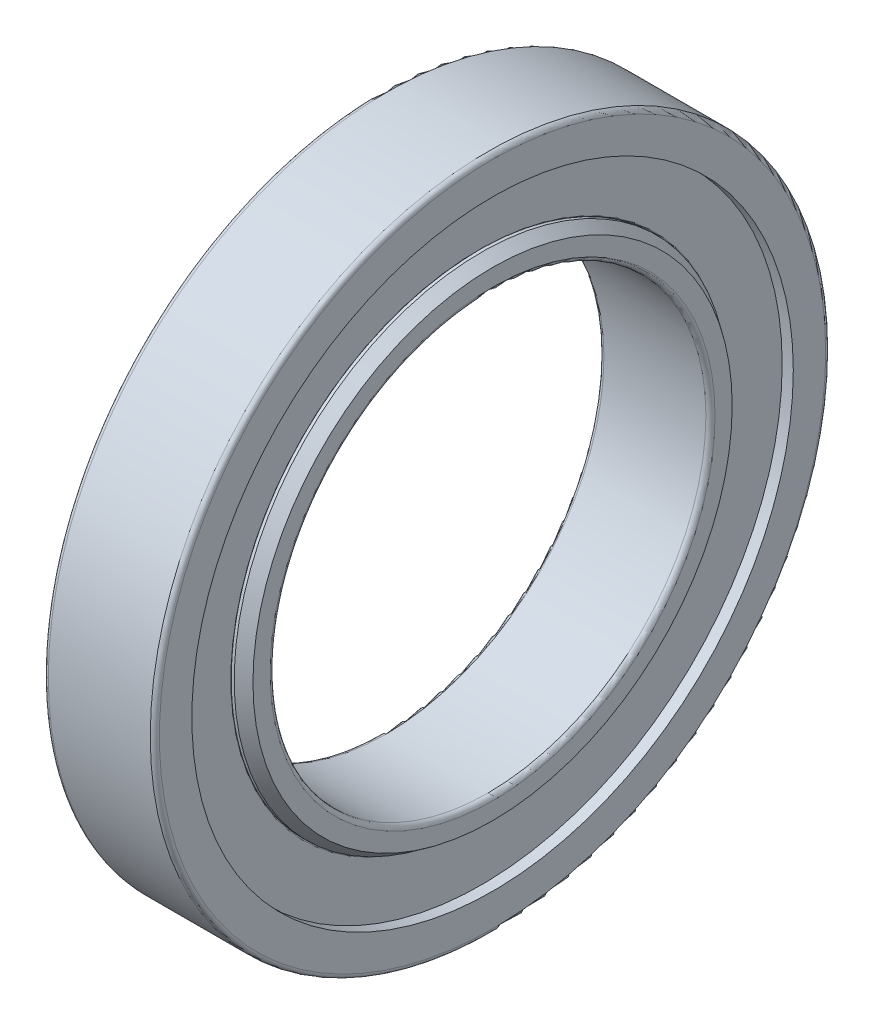
from build123d import *


with BuildPart() as part:
    # OutRacSke → OuterRace (revolve)
    with BuildSketch(Plane.XY):
        with BuildLine():
            Line((-20.4, 138.01875), (-25.5, 138.01875))
            Line((-25.5, 138.01875), (-25.5, 152.9))
            ThreePointArc((-25.5, 152.9), (-24.88492424, 154.38492424), (-23.4, 155))
            Line((-23.4, 155), (23.4, 155))
            ThreePointArc((23.4, 155), (24.88492424, 154.38492424), (25.5, 152.9))
            Line((25.5, 152.9), (25.5, 138.01875))
            Line((25.5, 138.01875), (20.4, 138.01875))
            Line((20.4, 138.01875), (20.4, 141.525))
            Line((20.4, 141.525), (-20.4, 141.525))
            Line((-20.4, 141.525), (-20.4, 138.01875))
        make_face()
    revolve(axis=Axis((-90, 0, 0), (1, 0, 0)))

    # RolSimSke → RollersSimplified (revolve)
    with BuildSketch(Plane(origin=(0, 101.6, 0), x_dir=(1, 0, 0), z_dir=(0, 0, 1))):
        with BuildLine():
            Line((-19.38, 39.3688), (-19.38, 12.4312))
            ThreePointArc((-19.38, 12.4312), (-19.215628326, 12.034371674), (-18.8188, 11.87))
            Line((-18.8188, 11.87), (18.8188, 11.87))
            ThreePointArc((18.8188, 11.87), (19.215628326, 12.034371674), (19.38, 12.4312))
            Line((19.38, 12.4312), (19.38, 39.3688))
            ThreePointArc((19.38, 39.3688), (19.215628326, 39.765628326), (18.8188, 39.93))
            Line((18.8188, 39.93), (-18.8188, 39.93))
            ThreePointArc((-18.8188, 39.93), (-19.215628326, 39.765628326), (-19.38, 39.3688))
        make_face()
    revolve(axis=Axis((25.4, 0, 0), (-1, 0, 0)))

    # InsRacSke → InnerRace (revolve)
    with BuildSketch(Plane.XY):
        with BuildLine():
            Line((-20.4, 113.475), (-25.5, 109.96875))
            Line((-25.5, 109.96875), (-25.5, 102.1))
            ThreePointArc((-25.5, 102.1), (-24.88492424, 100.61507576), (-23.4, 100))
            Line((-23.4, 100), (23.4, 100))
            ThreePointArc((23.4, 100), (24.88492424, 100.61507576), (25.5, 102.1))
            Line((25.5, 102.1), (25.5, 109.96875))
            Line((25.5, 109.96875), (20.4, 113.475))
            Line((20.4, 113.475), (-20.4, 113.475))
        make_face()
    revolve(axis=Axis((-90, 0, 0), (1, 0, 0)))


solid = part.part
